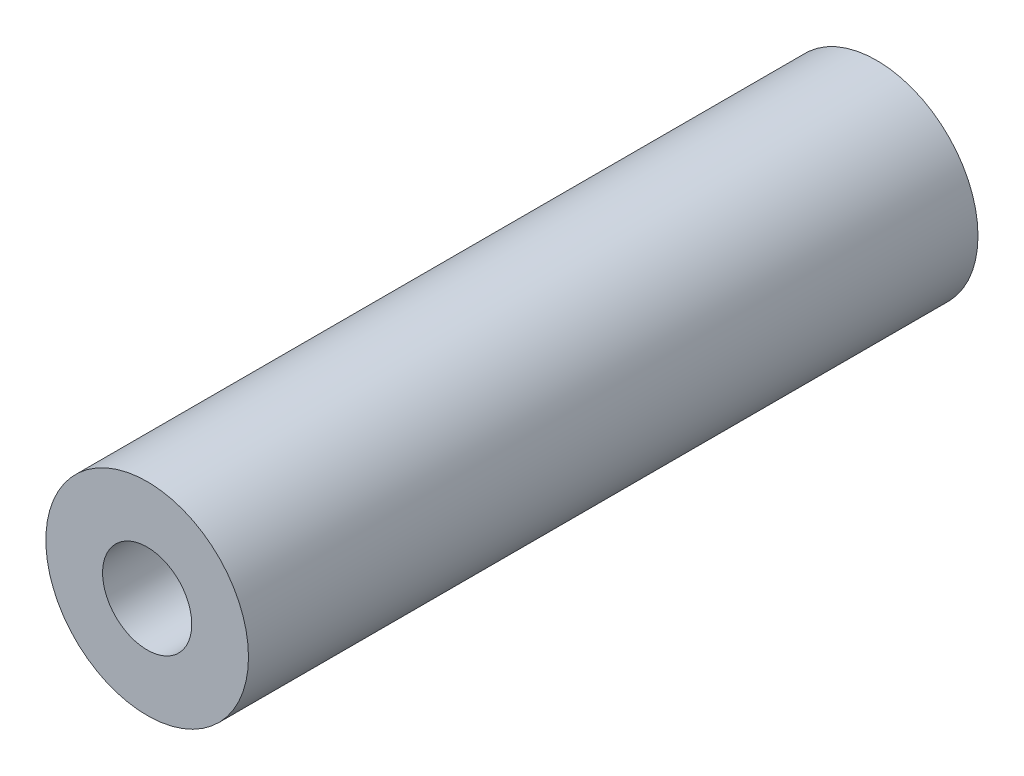
from build123d import *

# Parameters (mm, degrees)
SKETCH1_R             = 3.75
BOSS_EXTRUDE1_DEPTH   = 27
M4_TAPPED_HOLE1_D     = 3.3
M4_TAPPED_HOLE1_DEPTH = 5
M4_TAPPED_HOLE1_TIP   = 0.991420021
M4_TAPPED_HOLE2_D     = 3.3
M4_TAPPED_HOLE2_DEPTH = 7.1
M4_TAPPED_HOLE2_TIP   = 0.991420021
SCALE1_SCALE          = 1.013


with BuildPart() as part:
    # Sketch1 → Boss-Extrude1 (new body)
    with BuildSketch(Plane.XY):
        Circle(SKETCH1_R)
    extrude(amount=BOSS_EXTRUDE1_DEPTH)

    # M4 Tapped Hole1
    with Locations(Plane.XY.offset(27)):
        with Locations((0, 0)):
            Hole(M4_TAPPED_HOLE1_D / 2, depth=M4_TAPPED_HOLE1_DEPTH)
            with Locations((0, 0, -(M4_TAPPED_HOLE1_DEPTH + M4_TAPPED_HOLE1_TIP / 2))):  # 118° drill point
                Cone(0, M4_TAPPED_HOLE1_D / 2, M4_TAPPED_HOLE1_TIP, mode=Mode.SUBTRACT)

    # M4 Tapped Hole2
    with Locations(Plane(origin=(0, 0, 0), x_dir=(-1, 0, 0), z_dir=(0, 0, -1))):
        with Locations((0, 0)):
            Hole(M4_TAPPED_HOLE2_D / 2, depth=M4_TAPPED_HOLE2_DEPTH)
            with Locations((0, 0, -(M4_TAPPED_HOLE2_DEPTH + M4_TAPPED_HOLE2_TIP / 2))):  # 118° drill point
                Cone(0, M4_TAPPED_HOLE2_D / 2, M4_TAPPED_HOLE2_TIP, mode=Mode.SUBTRACT)


with BuildPart() as part_1:
    # Scale1: scaled about (0, 0, 13.618001469)
    add(part.part.scale(SCALE1_SCALE).moved(Location((0, 0, -0.177034019))))


solid = part_1.part
